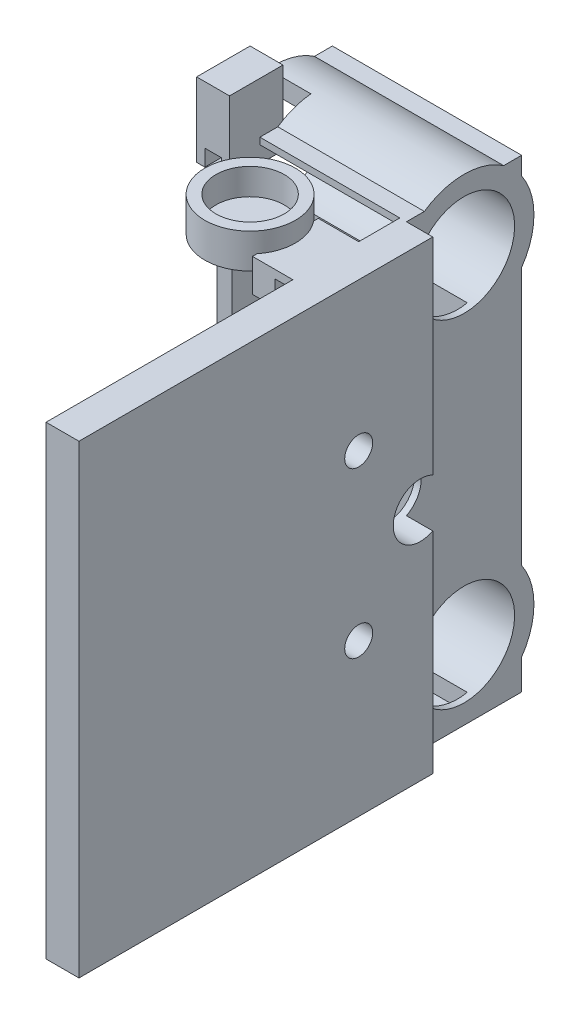
from build123d import *
from build123d.topology import SkipClean

# Parameters (mm, degrees)
GUIDE_CARRIER_BODY_SKETCH_W                    = 23
GUIDE_CARRIER_BODY_SKETCH_H                    = 56.5
GUIDE_CARRIER_BODY_DEPTH                       = 14
REAR_CLAMP_WALL_SKETCH_W                       = 4
REAR_CLAMP_WALL_SKETCH_H                       = 56.5
REAR_CLAMP_WALL_DEPTH                          = 43
GUIDE_BUSH_BOSS_1_SKETCH_R                     = 8.5
GUIDE_BUSH_BOSS_1_DEPTH                        = 23
GUIDE_BUSH_BOSS_2_SKETCH_R                     = 8.5
GUIDE_BUSH_BOSS_2_DEPTH                        = 23
STEEL_TUBE_CAVITY_SKETCH_W                     = 20.4
STEEL_TUBE_CAVITY_SKETCH_H                     = 55.4
STEEL_TUBE_CAVITY_DEPTH                        = 40.4
GUIDE_BUSH_BORE_1_SKETCH_R                     = 6.15
GUIDE_BUSH_BORE_1_DEPTH                        = 23.3
GUIDE_BUSH_BORE_2_SKETCH_R                     = 6.15
GUIDE_BUSH_BORE_2_DEPTH                        = 23.3
CLAMP_BOLT_CLEARANCE_1_SKETCH_R                = 1.7
CLAMP_BOLT_CLEARANCE_1_DEPTH                   = 4.3
CLAMP_BOLT_CLEARANCE_2_SKETCH_R                = 1.7
CLAMP_BOLT_CLEARANCE_2_DEPTH                   = 4.3
TRAVEL_FLAG_ROOT_SKETCH_W                      = 4
TRAVEL_FLAG_ROOT_SKETCH_H                      = 5
TRAVEL_FLAG_ROOT_DEPTH                         = 6
MAGNET_HOLDER_BRIDGE_SKETCH_W                  = 8.908
MAGNET_HOLDER_BRIDGE_SKETCH_H                  = 4
MAGNET_HOLDER_BRIDGE_DEPTH                     = 8
MAGNET_HOLDER_BOSS_SKETCH_R                    = 5.5
MAGNET_HOLDER_BOSS_DEPTH                       = 4.2
MAGNET_SEATING_POCKET_SKETCH_R                 = 4.15
MAGNET_SEATING_POCKET_DEPTH                    = 3.3
STEEL_CORE_CLEARANCE_TOOL_STEEL_TUBE_2_W       = 20
STEEL_CORE_CLEARANCE_TOOL_STEEL_TUBE_2_H       = 55
STEEL_CORE_CLEARANCE_TOOL_STEEL_TUBE_STO_DEPTH = 40
STEEL_CORE_CLEARANCE_TOOL_TUBE_INTER_2_W       = 16
STEEL_CORE_CLEARANCE_TOOL_TUBE_INTER_2_H       = 55.2
STEEL_CORE_CLEARANCE_TOOL_TUBE_INTERIOR_DEPTH  = 36
STEEL_CORE_CLEARANCE_TOOL_GUIDE_BUSH_2_R       = 6.2
STEEL_CORE_CLEARANCE_TOOL_GUIDE_BUSH_CLE_DEPTH = 20.3
STEEL_CORE_CLEARANCE_TOOL_GUIDE_BUSH_4_R       = 6.2
STEEL_CORE_CLEARANCE_TOOL_GUIDE_BUSH_3_DEPTH   = 20.3
STEEL_CORE_CLEARANCE_TOOL_SCREW_THRO_2_R       = 3.3
STEEL_CORE_CLEARANCE_TOOL_SCREW_THROUGH_DEPTH  = 20.3
STEEL_CORE_CLEARANCE_TOOL_SPRING_PIN_2_R       = 1.7
STEEL_CORE_CLEARANCE_TOOL_SPRING_PIN_CLE_DEPTH = 2.2
STEEL_CORE_CLEARANCE_TOOL_SPRING_PIN_4_R       = 1.7
STEEL_CORE_CLEARANCE_TOOL_SPRING_PIN_3_DEPTH   = 2.2
STEEL_CORE_CLEARANCE_TOOL_SPRING_PIN_6_R       = 1.7
STEEL_CORE_CLEARANCE_TOOL_SPRING_PIN_5_DEPTH   = 2.2
STEEL_CORE_CLEARANCE_TOOL_CLAMP_BOLT_2_R       = 1.7
STEEL_CORE_CLEARANCE_TOOL_CLAMP_BOLT_CLE_DEPTH = 2.3
STEEL_CORE_CLEARANCE_TOOL_CLAMP_BOLT_4_R       = 1.7
STEEL_CORE_CLEARANCE_TOOL_CLAMP_BOLT_3_DEPTH   = 2.3
SCREW_FULL_TRAVEL_CLEARANCE_SKETCH_R           = 3.3
SCREW_FULL_TRAVEL_CLEARANCE_DEPTH              = 26.7
TRAVEL_FLAG_RELIEF_SKETCH_W                    = 4.3
TRAVEL_FLAG_RELIEF_SKETCH_H                    = 5.2
TRAVEL_FLAG_RELIEF_DEPTH                       = 6.3
CLEARANCED_TRAVEL_STOP_FLAG_DEPTH              = 4
FINAL_CORE_CLEARANCE_TOOL_STEEL_TUBE_2_W       = 20
FINAL_CORE_CLEARANCE_TOOL_STEEL_TUBE_2_H       = 55
FINAL_CORE_CLEARANCE_TOOL_STEEL_TUBE_STO_DEPTH = 40
FINAL_CORE_CLEARANCE_TOOL_TUBE_INTER_2_W       = 16
FINAL_CORE_CLEARANCE_TOOL_TUBE_INTER_2_H       = 55.2
FINAL_CORE_CLEARANCE_TOOL_TUBE_INTERIOR_DEPTH  = 36
FINAL_CORE_CLEARANCE_TOOL_GUIDE_BUSH_2_R       = 6.2
FINAL_CORE_CLEARANCE_TOOL_GUIDE_BUSH_CLE_DEPTH = 20.3
FINAL_CORE_CLEARANCE_TOOL_GUIDE_BUSH_4_R       = 6.2
FINAL_CORE_CLEARANCE_TOOL_GUIDE_BUSH_3_DEPTH   = 20.3
FINAL_CORE_CLEARANCE_TOOL_SCREW_THRO_2_R       = 3.3
FINAL_CORE_CLEARANCE_TOOL_SCREW_THROUGH_DEPTH  = 20.3
FINAL_CORE_CLEARANCE_TOOL_SPRING_PIN_2_R       = 1.7
FINAL_CORE_CLEARANCE_TOOL_SPRING_PIN_CLE_DEPTH = 2.2
FINAL_CORE_CLEARANCE_TOOL_SPRING_PIN_4_R       = 1.7
FINAL_CORE_CLEARANCE_TOOL_SPRING_PIN_3_DEPTH   = 2.2
FINAL_CORE_CLEARANCE_TOOL_SPRING_PIN_6_R       = 1.7
FINAL_CORE_CLEARANCE_TOOL_SPRING_PIN_5_DEPTH   = 2.2
FINAL_CORE_CLEARANCE_TOOL_CLAMP_BOLT_2_R       = 1.7
FINAL_CORE_CLEARANCE_TOOL_CLAMP_BOLT_CLE_DEPTH = 2.3
FINAL_CORE_CLEARANCE_TOOL_CLAMP_BOLT_4_R       = 1.7
FINAL_CORE_CLEARANCE_TOOL_CLAMP_BOLT_3_DEPTH   = 2.3


with BuildPart() as part:
    # Guide carrier body sketch → Guide carrier body (new body)
    with BuildSketch(Plane.XY.offset(-35)):
        with Locations((39.208348754, -28.75)):
            Rectangle(GUIDE_CARRIER_BODY_SKETCH_W, GUIDE_CARRIER_BODY_SKETCH_H)
    extrude(amount=GUIDE_CARRIER_BODY_DEPTH)

    # Rear clamp wall sketch → Rear clamp wall (add)
    with BuildSketch(Plane.XY.offset(-21)):
        with Locations((51.908348754, -28.75)):
            Rectangle(REAR_CLAMP_WALL_SKETCH_W, REAR_CLAMP_WALL_SKETCH_H)
    extrude(amount=REAR_CLAMP_WALL_DEPTH)

    # Guide bush boss 1 sketch → Guide bush boss 1 (add)
    with BuildSketch(Plane(origin=(27.708348754, 0, 0), x_dir=(0, 0, -1), z_dir=(1, 0, 0))):
        with Locations((28, -9)):
            Circle(GUIDE_BUSH_BOSS_1_SKETCH_R)
    extrude(amount=GUIDE_BUSH_BOSS_1_DEPTH)

    # Guide bush boss 2 sketch → Guide bush boss 2 (add)
    with BuildSketch(Plane(origin=(27.708348754, 0, 0), x_dir=(0, 0, -1), z_dir=(1, 0, 0))):
        with Locations((28, -50)):
            Circle(GUIDE_BUSH_BOSS_2_SKETCH_R)
    extrude(amount=GUIDE_BUSH_BOSS_2_DEPTH)

    # Steel tube cavity sketch → Steel tube cavity (cut)
    with BuildSketch(Plane.XY.offset(-29.2)):
        with Locations((39.708348754, -28.5)):
            Rectangle(STEEL_TUBE_CAVITY_SKETCH_W, STEEL_TUBE_CAVITY_SKETCH_H)
    extrude(amount=STEEL_TUBE_CAVITY_DEPTH, mode=Mode.SUBTRACT)

    # Guide bush bore 1 sketch → Guide bush bore 1 (cut)
    with BuildSketch(Plane(origin=(27.6, 0, 0), x_dir=(0, 0, -1), z_dir=(1, 0, 0))):
        with Locations((28, -9)):
            Circle(GUIDE_BUSH_BORE_1_SKETCH_R)
    extrude(amount=GUIDE_BUSH_BORE_1_DEPTH, mode=Mode.SUBTRACT)

    # Guide bush bore 2 sketch → Guide bush bore 2 (cut)
    with BuildSketch(Plane(origin=(27.6, 0, 0), x_dir=(0, 0, -1), z_dir=(1, 0, 0))):
        with Locations((28, -50)):
            Circle(GUIDE_BUSH_BORE_2_SKETCH_R)
    extrude(amount=GUIDE_BUSH_BORE_2_DEPTH, mode=Mode.SUBTRACT)

    # Clamp bolt clearance 1 sketch → Clamp bolt clearance 1 (cut)
    with BuildSketch(Plane(origin=(49.8, 0, 0), x_dir=(0, 0, -1), z_dir=(1, 0, 0))):
        with Locations((12, -19)):
            Circle(CLAMP_BOLT_CLEARANCE_1_SKETCH_R)
    extrude(amount=CLAMP_BOLT_CLEARANCE_1_DEPTH, mode=Mode.SUBTRACT)

    # Clamp bolt clearance 2 sketch → Clamp bolt clearance 2 (cut)
    with BuildSketch(Plane(origin=(49.8, 0, 0), x_dir=(0, 0, -1), z_dir=(1, 0, 0))):
        with Locations((12, -39)):
            Circle(CLAMP_BOLT_CLEARANCE_2_SKETCH_R)
    extrude(amount=CLAMP_BOLT_CLEARANCE_2_DEPTH, mode=Mode.SUBTRACT)

    # Travel flag root sketch → Travel flag root (add)
    with BuildSketch(Plane.XY.offset(-27)):
        with Locations((30.708348754, -56.5)):
            Rectangle(TRAVEL_FLAG_ROOT_SKETCH_W, TRAVEL_FLAG_ROOT_SKETCH_H)
    extrude(amount=TRAVEL_FLAG_ROOT_DEPTH)

    # Magnet holder bridge sketch → Magnet holder bridge (add)
    with BuildSketch(Plane.XY.offset(-16)):
        with Locations((49.454, -55)):
            Rectangle(MAGNET_HOLDER_BRIDGE_SKETCH_W, MAGNET_HOLDER_BRIDGE_SKETCH_H)
    extrude(amount=MAGNET_HOLDER_BRIDGE_DEPTH)

    # Magnet holder boss sketch → Magnet holder boss (add)
    with BuildSketch(Plane(origin=(0, -59.4, 0), x_dir=(1, 0, 0), z_dir=(0, 1, 0))):
        with Locations((40.708, 12)):
            Circle(MAGNET_HOLDER_BOSS_SKETCH_R)
    extrude(amount=MAGNET_HOLDER_BOSS_DEPTH)

    # Magnet seating pocket sketch → Magnet seating pocket (cut)
    with BuildSketch(Plane(origin=(0, -59.5, 0), x_dir=(1, 0, 0), z_dir=(0, 1, 0))):
        with Locations((40.708, 12)):
            Circle(MAGNET_SEATING_POCKET_SKETCH_R)
    extrude(amount=MAGNET_SEATING_POCKET_DEPTH, mode=Mode.SUBTRACT)


with BuildPart() as body_2:
    # Steel core clearance tool Steel tube 2 → Steel core clearance tool Steel tube sto (new body)
    with BuildSketch(Plane.XY.offset(-29)):
        with Locations((39.708348754, -28.5)):
            Rectangle(STEEL_CORE_CLEARANCE_TOOL_STEEL_TUBE_2_W, STEEL_CORE_CLEARANCE_TOOL_STEEL_TUBE_2_H)
    extrude(amount=STEEL_CORE_CLEARANCE_TOOL_STEEL_TUBE_STO_DEPTH)

    # Steel core clearance tool Tube inter 2 → Steel core clearance tool Tube interior (cut)
    with BuildSketch(Plane.XY.offset(-27)):
        with Locations((39.708348754, -28.5)):
            Rectangle(STEEL_CORE_CLEARANCE_TOOL_TUBE_INTER_2_W, STEEL_CORE_CLEARANCE_TOOL_TUBE_INTER_2_H)
    extrude(amount=STEEL_CORE_CLEARANCE_TOOL_TUBE_INTERIOR_DEPTH, mode=Mode.SUBTRACT)

    # Steel core clearance tool Guide bush 2 → Steel core clearance tool Guide bush cle (cut)
    with BuildSketch(Plane(origin=(29.6, 0, 0), x_dir=(0, 0, -1), z_dir=(1, 0, 0))):
        with Locations((28, -9)):
            Circle(STEEL_CORE_CLEARANCE_TOOL_GUIDE_BUSH_2_R)
    extrude(amount=STEEL_CORE_CLEARANCE_TOOL_GUIDE_BUSH_CLE_DEPTH, mode=Mode.SUBTRACT)

    # Steel core clearance tool Guide bush 4 → Steel core clearance tool Guide bush 3 (cut)
    with BuildSketch(Plane(origin=(29.6, 0, 0), x_dir=(0, 0, -1), z_dir=(1, 0, 0))):
        with Locations((28, -50)):
            Circle(STEEL_CORE_CLEARANCE_TOOL_GUIDE_BUSH_4_R)
    extrude(amount=STEEL_CORE_CLEARANCE_TOOL_GUIDE_BUSH_3_DEPTH, mode=Mode.SUBTRACT)

    # Steel core clearance tool Screw thro 2 → Steel core clearance tool Screw through (cut)
    with BuildSketch(Plane(origin=(29.6, 0, 0), x_dir=(0, 0, -1), z_dir=(1, 0, 0))):
        with Locations((19.5, -29)):
            Circle(STEEL_CORE_CLEARANCE_TOOL_SCREW_THRO_2_R)
    extrude(amount=STEEL_CORE_CLEARANCE_TOOL_SCREW_THROUGH_DEPTH, mode=Mode.SUBTRACT)

    # Steel core clearance tool Spring pin 2 → Steel core clearance tool Spring pin cle (cut)
    with BuildSketch(Plane.XY.offset(8.9)):
        with Locations((35.708348754, -12)):
            Circle(STEEL_CORE_CLEARANCE_TOOL_SPRING_PIN_2_R)
    extrude(amount=STEEL_CORE_CLEARANCE_TOOL_SPRING_PIN_CLE_DEPTH, mode=Mode.SUBTRACT)

    # Steel core clearance tool Spring pin 4 → Steel core clearance tool Spring pin 3 (cut)
    with BuildSketch(Plane.XY.offset(8.9)):
        with Locations((35.708348754, -29)):
            Circle(STEEL_CORE_CLEARANCE_TOOL_SPRING_PIN_4_R)
    extrude(amount=STEEL_CORE_CLEARANCE_TOOL_SPRING_PIN_3_DEPTH, mode=Mode.SUBTRACT)

    # Steel core clearance tool Spring pin 6 → Steel core clearance tool Spring pin 5 (cut)
    with BuildSketch(Plane.XY.offset(8.9)):
        with Locations((35.708348754, -46)):
            Circle(STEEL_CORE_CLEARANCE_TOOL_SPRING_PIN_6_R)
    extrude(amount=STEEL_CORE_CLEARANCE_TOOL_SPRING_PIN_5_DEPTH, mode=Mode.SUBTRACT)

    # Steel core clearance tool Clamp bolt 2 → Steel core clearance tool Clamp bolt cle (cut)
    with BuildSketch(Plane(origin=(47.6, 0, 0), x_dir=(0, 0, -1), z_dir=(1, 0, 0))):
        with Locations((12, -19)):
            Circle(STEEL_CORE_CLEARANCE_TOOL_CLAMP_BOLT_2_R)
    extrude(amount=STEEL_CORE_CLEARANCE_TOOL_CLAMP_BOLT_CLE_DEPTH, mode=Mode.SUBTRACT)

    # Steel core clearance tool Clamp bolt 4 → Steel core clearance tool Clamp bolt 3 (cut)
    with BuildSketch(Plane(origin=(47.6, 0, 0), x_dir=(0, 0, -1), z_dir=(1, 0, 0))):
        with Locations((12, -39)):
            Circle(STEEL_CORE_CLEARANCE_TOOL_CLAMP_BOLT_4_R)
    extrude(amount=STEEL_CORE_CLEARANCE_TOOL_CLAMP_BOLT_3_DEPTH, mode=Mode.SUBTRACT)


with BuildPart() as part_1:
    add(part.part)

    # Combine1: cut body 2
    add(body_2.part, mode=Mode.SUBTRACT)

    # Screw full travel clearance sketch → Screw full travel clearance (cut)
    with BuildSketch(Plane(origin=(27.5, 0, 0), x_dir=(0, 0, -1), z_dir=(1, 0, 0))):
        with Locations((19.5, -29)):
            Circle(SCREW_FULL_TRAVEL_CLEARANCE_SKETCH_R)
    extrude(amount=SCREW_FULL_TRAVEL_CLEARANCE_DEPTH, mode=Mode.SUBTRACT)

    # Travel flag relief sketch → Travel flag relief (cut)
    with BuildSketch(Plane.XY.offset(-27.2)):
        with Locations((30.75, -56.6)):
            Rectangle(TRAVEL_FLAG_RELIEF_SKETCH_W, TRAVEL_FLAG_RELIEF_SKETCH_H)
    extrude(amount=TRAVEL_FLAG_RELIEF_DEPTH, mode=Mode.SUBTRACT)

    # Clearanced travel flag sketch → Clearanced travel stop flag (add)
    with SkipClean():  # the faces are left unmerged after this step: merging them gives an invalid solid
        with BuildSketch(Plane(origin=(28.708348754, 0, 0), x_dir=(0, 0, -1), z_dir=(1, 0, 0))):
            with BuildLine():
                Line((17.5, -63), (24, -63))
                Line((24, -63), (24, -54.671455876))
                ThreePointArc((24, -54.671455876), (23.651293296, -54.348706704), (23.328544124, -54))
                Line((23.328544124, -54), (17.5, -54))
                Line((17.5, -54), (17.5, -63))
            make_face()
        extrude(amount=CLEARANCED_TRAVEL_STOP_FLAG_DEPTH)


with BuildPart() as body_2_2:
    # Final core clearance tool Steel tube 2 → Final core clearance tool Steel tube sto (new body)
    with BuildSketch(Plane.XY.offset(-29)):
        with Locations((39.708348754, -28.5)):
            Rectangle(FINAL_CORE_CLEARANCE_TOOL_STEEL_TUBE_2_W, FINAL_CORE_CLEARANCE_TOOL_STEEL_TUBE_2_H)
    extrude(amount=FINAL_CORE_CLEARANCE_TOOL_STEEL_TUBE_STO_DEPTH)

    # Final core clearance tool Tube inter 2 → Final core clearance tool Tube interior (cut)
    with BuildSketch(Plane.XY.offset(-27)):
        with Locations((39.708348754, -28.5)):
            Rectangle(FINAL_CORE_CLEARANCE_TOOL_TUBE_INTER_2_W, FINAL_CORE_CLEARANCE_TOOL_TUBE_INTER_2_H)
    extrude(amount=FINAL_CORE_CLEARANCE_TOOL_TUBE_INTERIOR_DEPTH, mode=Mode.SUBTRACT)

    # Final core clearance tool Guide bush 2 → Final core clearance tool Guide bush cle (cut)
    with BuildSketch(Plane(origin=(29.6, 0, 0), x_dir=(0, 0, -1), z_dir=(1, 0, 0))):
        with Locations((28, -9)):
            Circle(FINAL_CORE_CLEARANCE_TOOL_GUIDE_BUSH_2_R)
    extrude(amount=FINAL_CORE_CLEARANCE_TOOL_GUIDE_BUSH_CLE_DEPTH, mode=Mode.SUBTRACT)

    # Final core clearance tool Guide bush 4 → Final core clearance tool Guide bush 3 (cut)
    with BuildSketch(Plane(origin=(29.6, 0, 0), x_dir=(0, 0, -1), z_dir=(1, 0, 0))):
        with Locations((28, -50)):
            Circle(FINAL_CORE_CLEARANCE_TOOL_GUIDE_BUSH_4_R)
    extrude(amount=FINAL_CORE_CLEARANCE_TOOL_GUIDE_BUSH_3_DEPTH, mode=Mode.SUBTRACT)

    # Final core clearance tool Screw thro 2 → Final core clearance tool Screw through (cut)
    with BuildSketch(Plane(origin=(29.6, 0, 0), x_dir=(0, 0, -1), z_dir=(1, 0, 0))):
        with Locations((19.5, -29)):
            Circle(FINAL_CORE_CLEARANCE_TOOL_SCREW_THRO_2_R)
    extrude(amount=FINAL_CORE_CLEARANCE_TOOL_SCREW_THROUGH_DEPTH, mode=Mode.SUBTRACT)

    # Final core clearance tool Spring pin 2 → Final core clearance tool Spring pin cle (cut)
    with BuildSketch(Plane.XY.offset(8.9)):
        with Locations((35.708348754, -12)):
            Circle(FINAL_CORE_CLEARANCE_TOOL_SPRING_PIN_2_R)
    extrude(amount=FINAL_CORE_CLEARANCE_TOOL_SPRING_PIN_CLE_DEPTH, mode=Mode.SUBTRACT)

    # Final core clearance tool Spring pin 4 → Final core clearance tool Spring pin 3 (cut)
    with BuildSketch(Plane.XY.offset(8.9)):
        with Locations((35.708348754, -29)):
            Circle(FINAL_CORE_CLEARANCE_TOOL_SPRING_PIN_4_R)
    extrude(amount=FINAL_CORE_CLEARANCE_TOOL_SPRING_PIN_3_DEPTH, mode=Mode.SUBTRACT)

    # Final core clearance tool Spring pin 6 → Final core clearance tool Spring pin 5 (cut)
    with BuildSketch(Plane.XY.offset(8.9)):
        with Locations((35.708348754, -46)):
            Circle(FINAL_CORE_CLEARANCE_TOOL_SPRING_PIN_6_R)
    extrude(amount=FINAL_CORE_CLEARANCE_TOOL_SPRING_PIN_5_DEPTH, mode=Mode.SUBTRACT)

    # Final core clearance tool Clamp bolt 2 → Final core clearance tool Clamp bolt cle (cut)
    with BuildSketch(Plane(origin=(47.6, 0, 0), x_dir=(0, 0, -1), z_dir=(1, 0, 0))):
        with Locations((12, -19)):
            Circle(FINAL_CORE_CLEARANCE_TOOL_CLAMP_BOLT_2_R)
    extrude(amount=FINAL_CORE_CLEARANCE_TOOL_CLAMP_BOLT_CLE_DEPTH, mode=Mode.SUBTRACT)

    # Final core clearance tool Clamp bolt 4 → Final core clearance tool Clamp bolt 3 (cut)
    with BuildSketch(Plane(origin=(47.6, 0, 0), x_dir=(0, 0, -1), z_dir=(1, 0, 0))):
        with Locations((12, -39)):
            Circle(FINAL_CORE_CLEARANCE_TOOL_CLAMP_BOLT_4_R)
    extrude(amount=FINAL_CORE_CLEARANCE_TOOL_CLAMP_BOLT_3_DEPTH, mode=Mode.SUBTRACT)


with BuildPart() as part_2:
    add(part_1.part)

    # Combine2: cut body 2 2
    add(body_2_2.part, mode=Mode.SUBTRACT)


with BuildPart() as body_2_3:
    # Mirror1: mirrored copy
    add(part_2.part.mirror(Plane(origin=(0, 0, 0), x_dir=(0, 0, 1), z_dir=(0, -1, 0))))


solid = body_2_3.part
